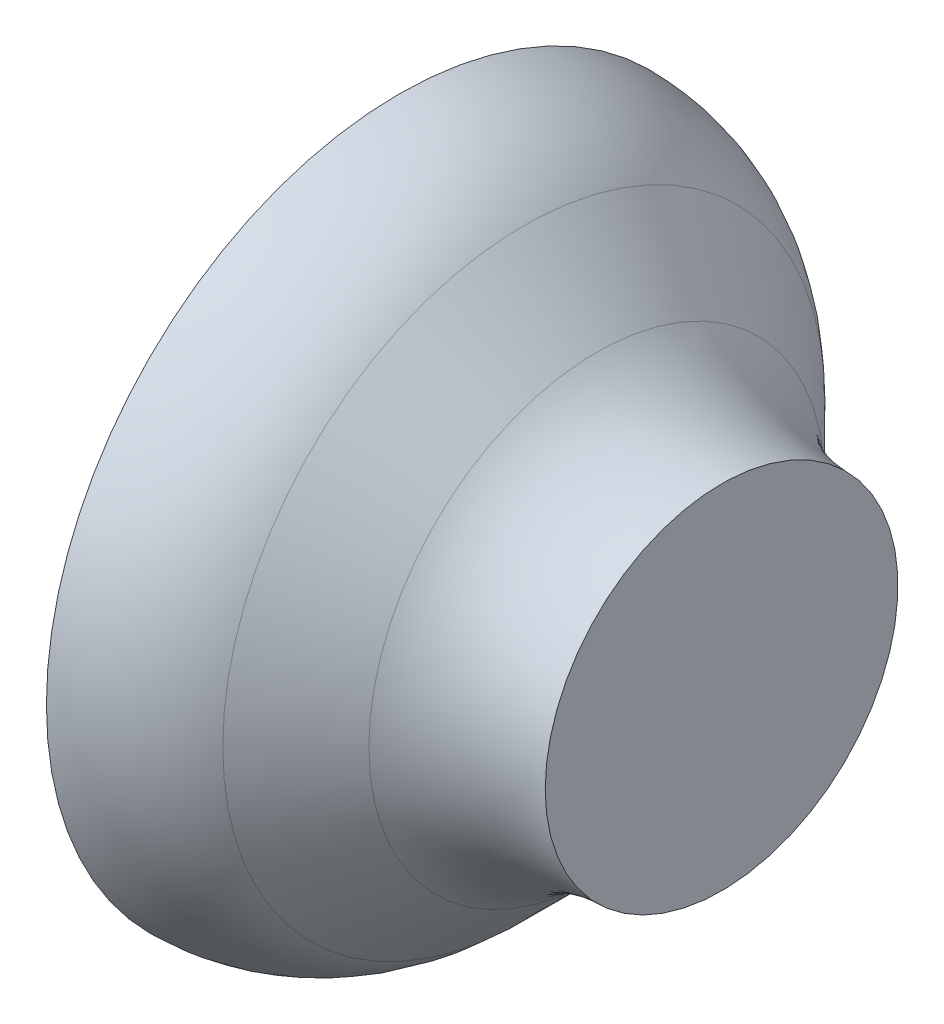
from build123d import *


with BuildPart() as part:
    # Sketch1 → Revolve1 (revolve)
    with BuildSketch(Plane.XY, mode=Mode.PRIVATE) as revolve1_sk:
        with BuildLine():
            Line((0, 35.7821992), (0, 0))
            Line((0, 0), (32.7125718, 0))
            Line((32.7125718, 0), (32.7125718, 17.8910996))
            ThreePointArc((32.7125718, 17.8910996), (25.865944396, 19.252978465), (20.06165395, 23.13128135))
            Line((20.06165395, 23.13128135), (12.65091785, 30.54201745))
            ThreePointArc((12.65091785, 30.54201745), (6.846627404, 34.420320335), (0, 35.7821992))
        make_face()
    revolve(revolve1_sk.sketch.rotate(Axis((0, 0, 0), (1, 0, 0)), 90), axis=Axis((0, 0, 0), (1, 0, 0)))


solid = part.part
